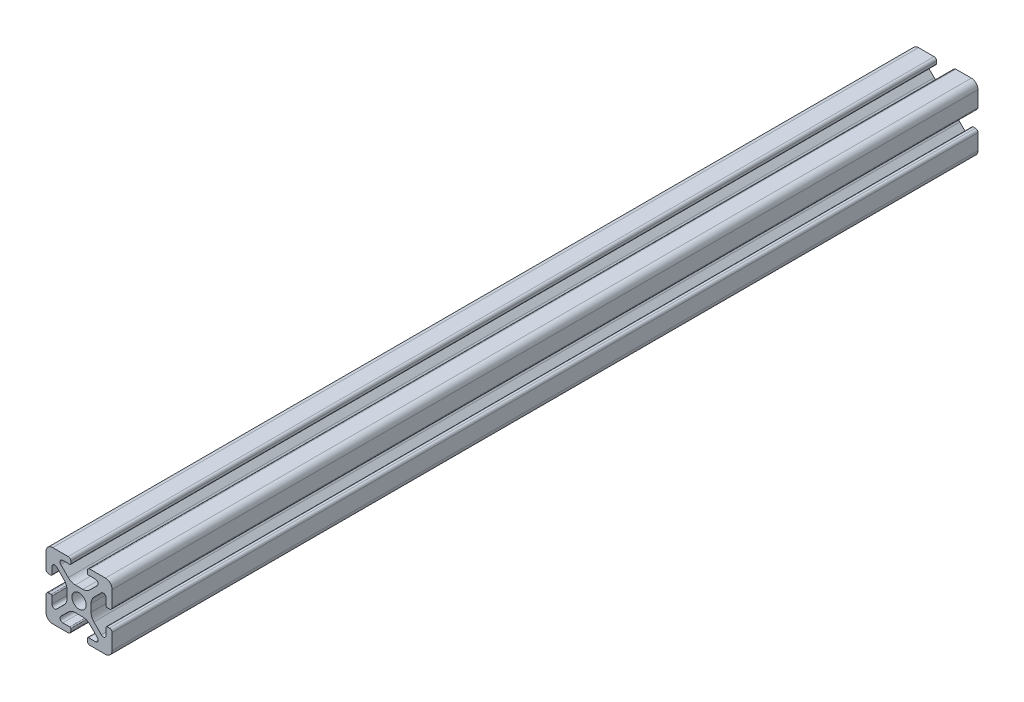
from build123d import *

# Parameters (mm, degrees)
SKETCH1_R           = 2.1463
BOSS_EXTRUDE1_DEPTH = 130.96875


with BuildPart() as part:
    # Sketch1 → Boss-Extrude1 (new, symmetric)
    with BuildSketch(Plane.XY):
        with BuildLine():
            Line((-9.9949, 7.9883), (-9.9949, 3.2893))
            ThreePointArc((-9.9949, 3.2893), (-9.76427588, 2.73252412), (-9.2075, 2.5019))
            Line((-9.2075, 2.5019), (-8.4963, 2.5019))
            ThreePointArc((-8.4963, 2.5019), (-8.280773853, 2.591173853), (-8.1915, 2.8067))
            Line((-8.1915, 2.8067), (-8.1915, 4.9149))
            ThreePointArc((-8.1915, 4.9149), (-7.674065253, 5.689295824), (-6.760603096, 5.507596904))
            Line((-6.760603096, 5.507596904), (-4.505765747, 3.252759555))
            ThreePointArc((-4.505765747, 3.252759555), (-3.856054457, 2.280397894), (-3.627906192, 1.133419111))
            Line((-3.627906192, 1.133419111), (-3.627906192, -1.133419111))
            ThreePointArc((-3.627906192, -1.133419111), (-3.856054457, -2.280397894), (-4.505765747, -3.252759555))
            Line((-4.505765747, -3.252759555), (-6.760603096, -5.507596904))
            ThreePointArc((-6.760603096, -5.507596904), (-7.674065253, -5.689295824), (-8.1915, -4.9149))
            Line((-8.1915, -4.9149), (-8.1915, -2.8067))
            ThreePointArc((-8.1915, -2.8067), (-8.280773853, -2.591173853), (-8.4963, -2.5019))
            Line((-8.4963, -2.5019), (-9.2075, -2.5019))
            ThreePointArc((-9.2075, -2.5019), (-9.76427588, -2.73252412), (-9.9949, -3.2893))
            Line((-9.9949, -3.2893), (-9.9949, -7.9883))
            ThreePointArc((-9.9949, -7.9883), (-9.407180467, -9.407180467), (-7.9883, -9.9949))
            Line((-7.9883, -9.9949), (-3.2893, -9.9949))
            ThreePointArc((-3.2893, -9.9949), (-2.73252412, -9.76427588), (-2.5019, -9.2075))
            Line((-2.5019, -9.2075), (-2.5019, -8.4963))
            ThreePointArc((-2.5019, -8.4963), (-2.591173853, -8.280773853), (-2.8067, -8.1915))
            Line((-2.8067, -8.1915), (-4.9149, -8.1915))
            ThreePointArc((-4.9149, -8.1915), (-5.689295824, -7.674065253), (-5.507596904, -6.760603096))
            Line((-5.507596904, -6.760603096), (-3.252759555, -4.505765747))
            ThreePointArc((-3.252759555, -4.505765747), (-2.280397894, -3.856054457), (-1.133419111, -3.627906192))
            Line((-1.133419111, -3.627906192), (1.133419111, -3.627906192))
            ThreePointArc((1.133419111, -3.627906192), (2.280397894, -3.856054457), (3.252759555, -4.505765747))
            Line((3.252759555, -4.505765747), (5.507596904, -6.760603096))
            ThreePointArc((5.507596904, -6.760603096), (5.689295824, -7.674065253), (4.9149, -8.1915))
            Line((4.9149, -8.1915), (2.8067, -8.1915))
            ThreePointArc((2.8067, -8.1915), (2.591173853, -8.280773853), (2.5019, -8.4963))
            Line((2.5019, -8.4963), (2.5019, -9.2075))
            ThreePointArc((2.5019, -9.2075), (2.73252412, -9.76427588), (3.2893, -9.9949))
            Line((3.2893, -9.9949), (7.9883, -9.9949))
            ThreePointArc((7.9883, -9.9949), (9.407180467, -9.407180467), (9.9949, -7.9883))
            Line((9.9949, -7.9883), (9.9949, -3.2893))
            ThreePointArc((9.9949, -3.2893), (9.76427588, -2.73252412), (9.2075, -2.5019))
            Line((9.2075, -2.5019), (8.4963, -2.5019))
            ThreePointArc((8.4963, -2.5019), (8.280773853, -2.591173853), (8.1915, -2.8067))
            Line((8.1915, -2.8067), (8.1915, -4.9149))
            ThreePointArc((8.1915, -4.9149), (7.674065253, -5.689295824), (6.760603096, -5.507596904))
            Line((6.760603096, -5.507596904), (4.505765747, -3.252759555))
            ThreePointArc((4.505765747, -3.252759555), (3.856054457, -2.280397894), (3.627906192, -1.133419111))
            Line((3.627906192, -1.133419111), (3.627906192, 1.133419111))
            ThreePointArc((3.627906192, 1.133419111), (3.856054457, 2.280397894), (4.505765747, 3.252759555))
            Line((4.505765747, 3.252759555), (6.760603096, 5.507596904))
            ThreePointArc((6.760603096, 5.507596904), (7.674065253, 5.689295824), (8.1915, 4.9149))
            Line((8.1915, 4.9149), (8.1915, 2.8067))
            ThreePointArc((8.1915, 2.8067), (8.280773853, 2.591173853), (8.4963, 2.5019))
            Line((8.4963, 2.5019), (9.2075, 2.5019))
            ThreePointArc((9.2075, 2.5019), (9.76427588, 2.73252412), (9.9949, 3.2893))
            Line((9.9949, 3.2893), (9.9949, 7.9883))
            ThreePointArc((9.9949, 7.9883), (9.407180467, 9.407180467), (7.9883, 9.9949))
            Line((7.9883, 9.9949), (3.2893, 9.9949))
            ThreePointArc((3.2893, 9.9949), (2.73252412, 9.76427588), (2.5019, 9.2075))
            Line((2.5019, 9.2075), (2.5019, 8.4963))
            ThreePointArc((2.5019, 8.4963), (2.591173853, 8.280773853), (2.8067, 8.1915))
            Line((2.8067, 8.1915), (4.9149, 8.1915))
            ThreePointArc((4.9149, 8.1915), (5.689295824, 7.674065253), (5.507596904, 6.760603096))
            Line((5.507596904, 6.760603096), (3.252759555, 4.505765747))
            ThreePointArc((3.252759555, 4.505765747), (2.280397894, 3.856054457), (1.133419111, 3.627906192))
            Line((1.133419111, 3.627906192), (-1.133419111, 3.627906192))
            ThreePointArc((-1.133419111, 3.627906192), (-2.280397894, 3.856054457), (-3.252759555, 4.505765747))
            Line((-3.252759555, 4.505765747), (-5.507596904, 6.760603096))
            ThreePointArc((-5.507596904, 6.760603096), (-5.689295824, 7.674065253), (-4.9149, 8.1915))
            Line((-4.9149, 8.1915), (-2.8067, 8.1915))
            ThreePointArc((-2.8067, 8.1915), (-2.591173853, 8.280773853), (-2.5019, 8.4963))
            Line((-2.5019, 8.4963), (-2.5019, 9.2075))
            ThreePointArc((-2.5019, 9.2075), (-2.73252412, 9.76427588), (-3.2893, 9.9949))
            Line((-3.2893, 9.9949), (-7.9883, 9.9949))
            ThreePointArc((-7.9883, 9.9949), (-9.407180467, 9.407180467), (-9.9949, 7.9883))
        make_face()
        Circle(SKETCH1_R, mode=Mode.SUBTRACT)
    extrude(amount=BOSS_EXTRUDE1_DEPTH, both=True)


solid = part.part
